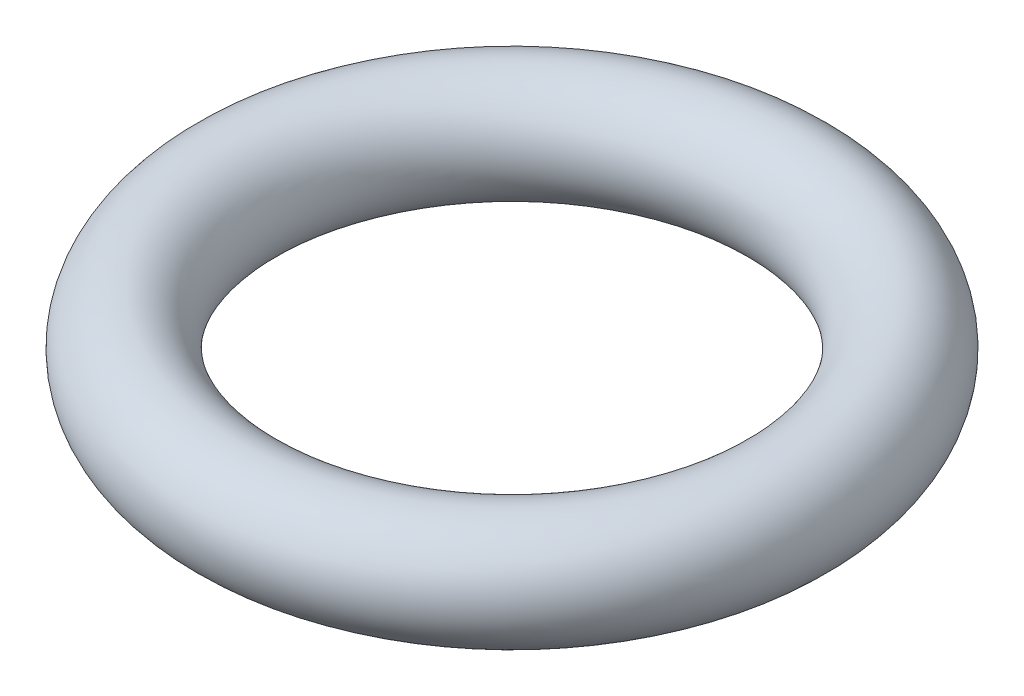
from build123d import *

# Parameters (mm, degrees)
SWEEP_1_PROFILE_R = 20


with BuildPart() as part:
    # 扫描1: sweep along a path in 草图1
    with BuildLine(Plane(origin=(0, 0, 0), x_dir=(1, 0, 0), z_dir=(0, 1, 0))) as sweep_1_path:
        CenterArc((0, 0), 100, 0, 360)
    # 扫描1 profile (on start of the path) → 扫描1 (sweep)
    with BuildSketch(Plane(origin=(100, 0, 0), x_dir=(-1, 0, 0), z_dir=(0, 0, -1))):
        Circle(SWEEP_1_PROFILE_R)
    sweep(path=sweep_1_path.line)


solid = part.part
